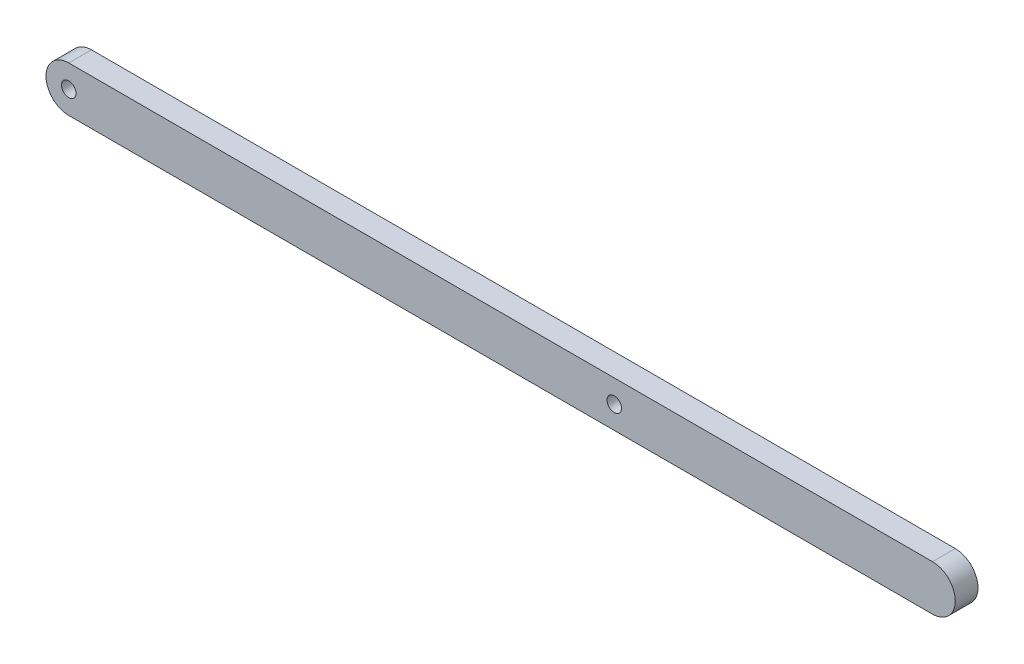
from build123d import *

# Parameters (mm, degrees)
SKETCH_1_R      = 1.6
EXTRUDE_1_DEPTH = 5


with BuildPart() as part:
    # 草图1 → 凸台-拉伸1 (new body)
    with BuildSketch(Plane.XY):
        with BuildLine():
            Line((0, 5), (190, 5))
            ThreePointArc((190, 5), (195, 0), (190, -5))
            Line((190, -5), (0, -5))
            ThreePointArc((0, -5), (-5, 0), (0, 5))
        make_face()
        with Locations((120, 0)):
            Circle(SKETCH_1_R, mode=Mode.SUBTRACT)
        Circle(SKETCH_1_R, mode=Mode.SUBTRACT)
    extrude(amount=EXTRUDE_1_DEPTH)


solid = part.part
